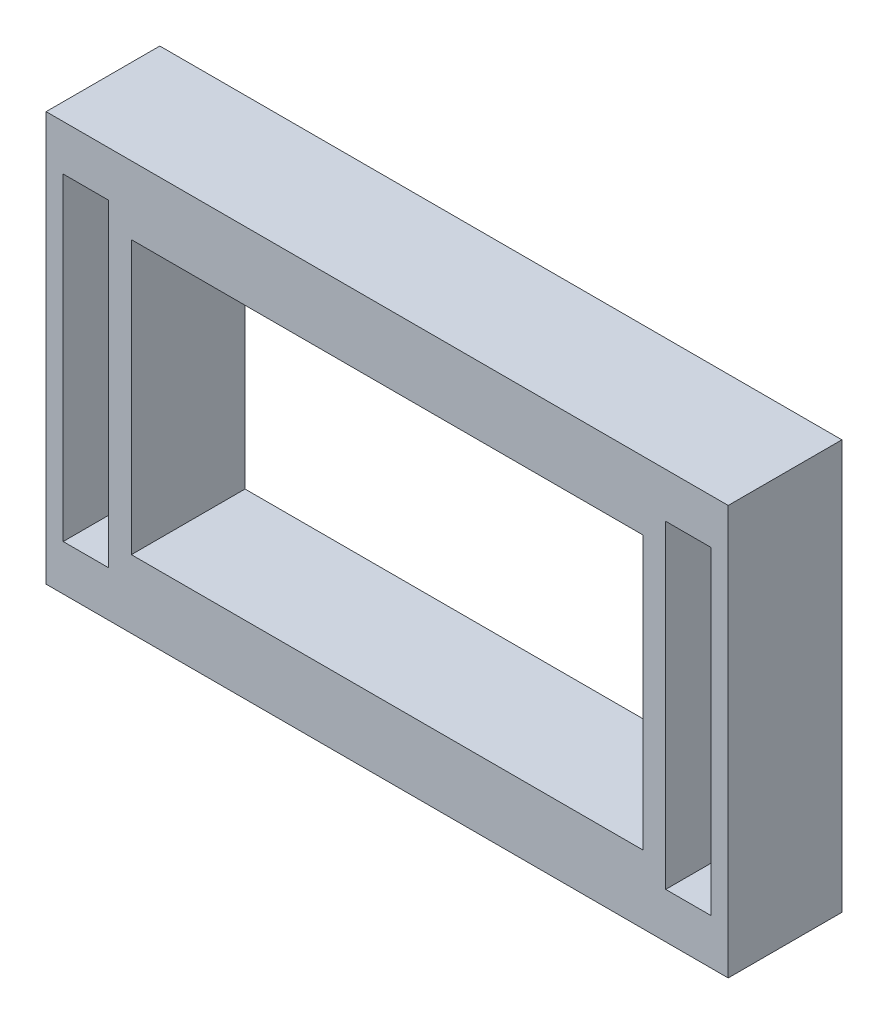
from build123d import *

# Parameters (mm, degrees)
SKETCH1_W           = 30
SKETCH1_H           = 18
SKETCH1_W_2         = 22.5
SKETCH1_H_2         = 12
BOSS_EXTRUDE2_DEPTH = 5
SKETCH2_W           = 2
SKETCH2_H           = 14
SKETCH2_H_2         = 14.02224411
CUT_EXTRUDE1_DEPTH  = 4


with BuildPart() as part:
    # Sketch1 → Boss-Extrude2 (new body)
    with BuildSketch(Plane.XY):
        Rectangle(SKETCH1_W, SKETCH1_H)
        Rectangle(SKETCH1_W_2, SKETCH1_H_2, mode=Mode.SUBTRACT)
    extrude(amount=BOSS_EXTRUDE2_DEPTH)

    # Sketch2 → Cut-Extrude1 (cut)
    with BuildSketch(Plane.XY.offset(5)):
        with Locations((-13.25, 0)):
            Rectangle(SKETCH2_W, SKETCH2_H)
        with Locations((13.25, 0.011122055)):
            Rectangle(SKETCH2_W, SKETCH2_H_2)
    extrude(amount=-CUT_EXTRUDE1_DEPTH, mode=Mode.SUBTRACT)


solid = part.part
